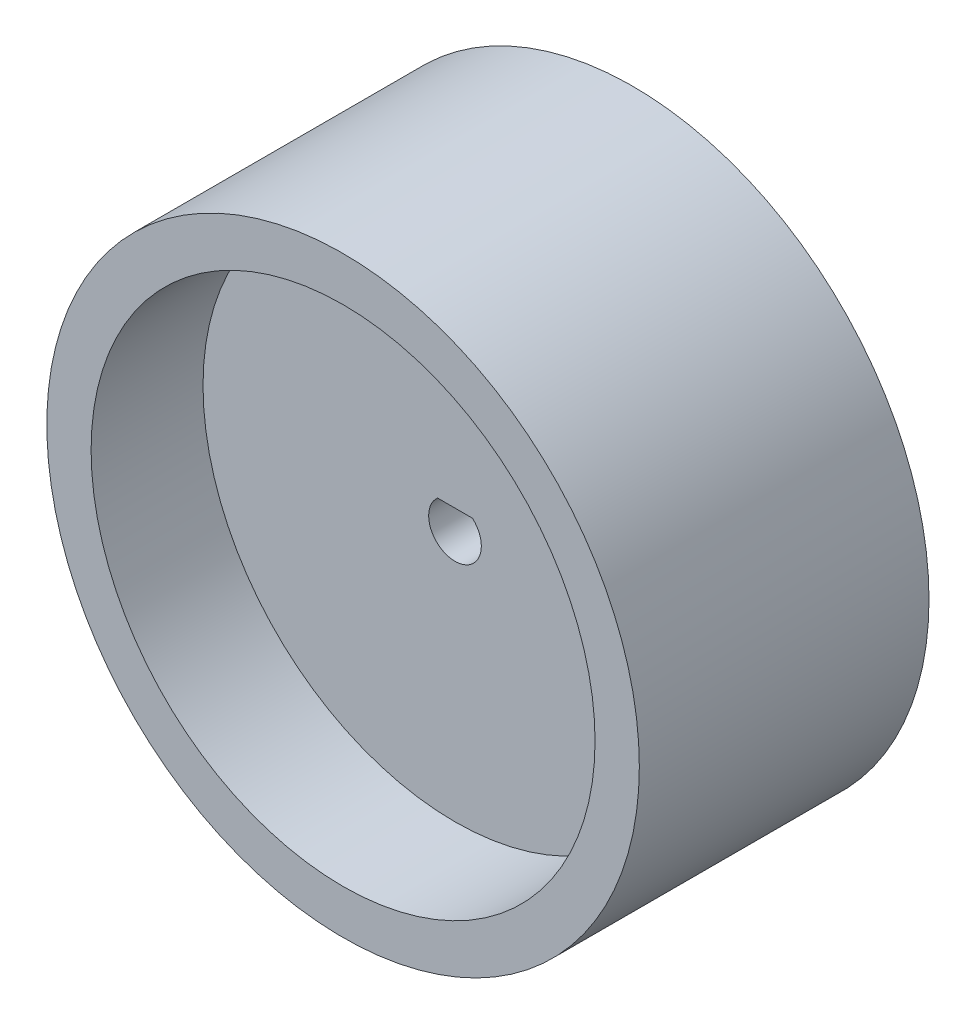
from build123d import *

# Parameters (mm, degrees)
SKETCH1_R           = 5
BOSS_EXTRUDE2_DEPTH = 13.5
SKETCH3_R           = 22.5
SKETCH3_R_2         = 19.136659322
BOSS_EXTRUDE3_DEPTH = 11
SKETCH4_R           = 20
SKETCH4_R_2         = 4.293447478
BOSS_EXTRUDE4_DEPTH = 2.5


with BuildPart() as part:
    # Sketch1 → Boss-Extrude2 (new body)
    with BuildSketch(Plane.XY.offset(1381.117015566)):
        with Locations((622.689594412, 901.072344281)):
            Circle(SKETCH1_R)
        with BuildLine():
            Line((621.366718756, 902.572344281), (624.012470067, 902.572344281))
            ThreePointArc((624.012470067, 902.572344281), (622.689594412, 899.072344281), (621.366718756, 902.572344281))
        make_face(mode=Mode.SUBTRACT)
    extrude(amount=BOSS_EXTRUDE2_DEPTH)



with BuildPart() as body_2:
    # Sketch3 → Boss-Extrude3 (new, symmetric)
    with BuildSketch(Plane.XY.offset(1392.117015566)):
        with Locations((622.689594412, 901.072344281)):
            Circle(SKETCH3_R)
        with Locations((622.689594412, 901.072344281)):
            Circle(SKETCH3_R_2, mode=Mode.SUBTRACT)
    extrude(amount=BOSS_EXTRUDE3_DEPTH, both=True)


with BuildPart() as part_1:
    add(part.part)

    add(body_2.part)  # Boss-Extrude4 merges body 2
    # Sketch4 → Boss-Extrude4 (add, symmetric)
    with BuildSketch(Plane.XY.offset(1392.117015566)):
        with Locations((622.689594412, 901.072344281)):
            Circle(SKETCH4_R)
        with Locations((622.689594412, 901.072344281)):
            Circle(SKETCH4_R_2, mode=Mode.SUBTRACT)
    extrude(amount=BOSS_EXTRUDE4_DEPTH, both=True)


solid = part_1.part
